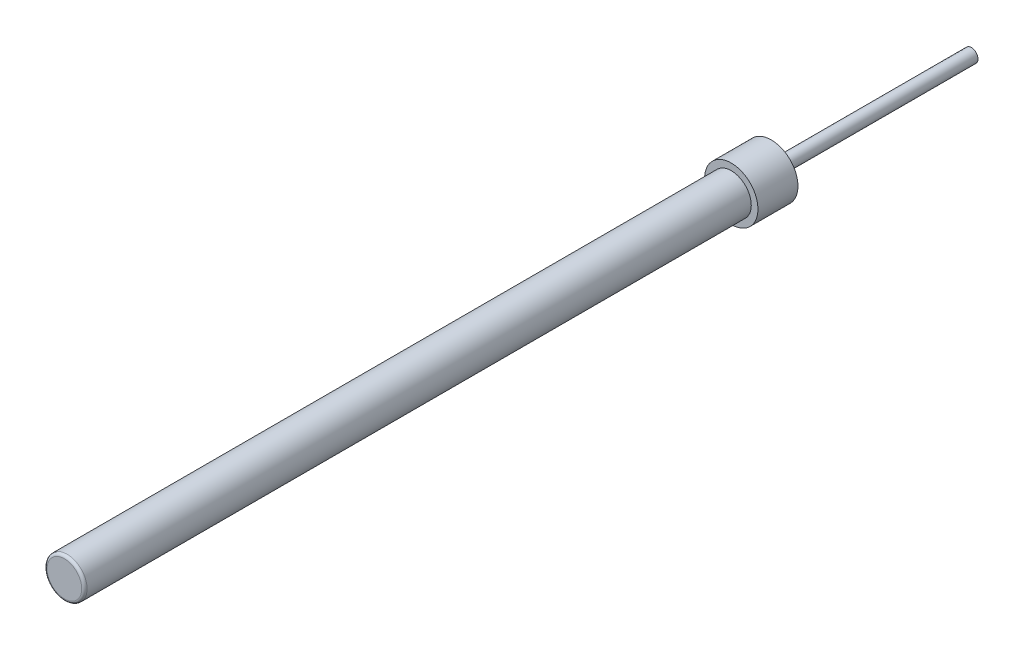
from build123d import *

# Parameters (mm, degrees)
SKETCH1_R           = 1.5
BOSS_EXTRUDE1_DEPTH = 50
FILLET2_R           = 0.2
SKETCH2_R           = 2
BOSS_EXTRUDE2_DEPTH = 3
SKETCH3_R           = 0.5
BOSS_EXTRUDE3_DEPTH = 15


with BuildPart() as part:
    # Sketch1 → Boss-Extrude1 (new body)
    with BuildSketch(Plane.XY):
        Circle(SKETCH1_R)
    extrude(amount=BOSS_EXTRUDE1_DEPTH)

    # Fillet2
    fillet2_edges = [part.edges().sort_by_distance(p)[0] for p in [
        (-1.5, 0, 50),
    ]]
    fillet(fillet2_edges, radius=FILLET2_R)

    # Sketch2 → Boss-Extrude2 (add)
    with BuildSketch(Plane(origin=(0, 0, 0), x_dir=(-1, 0, 0), z_dir=(0, 0, -1))):
        Circle(SKETCH2_R)
    extrude(amount=BOSS_EXTRUDE2_DEPTH)

    # Sketch3 → Boss-Extrude3 (add)
    with BuildSketch(Plane(origin=(0, 0, -3), x_dir=(-1, 0, 0), z_dir=(0, 0, -1))):
        Circle(SKETCH3_R)
    extrude(amount=BOSS_EXTRUDE3_DEPTH)


solid = part.part
